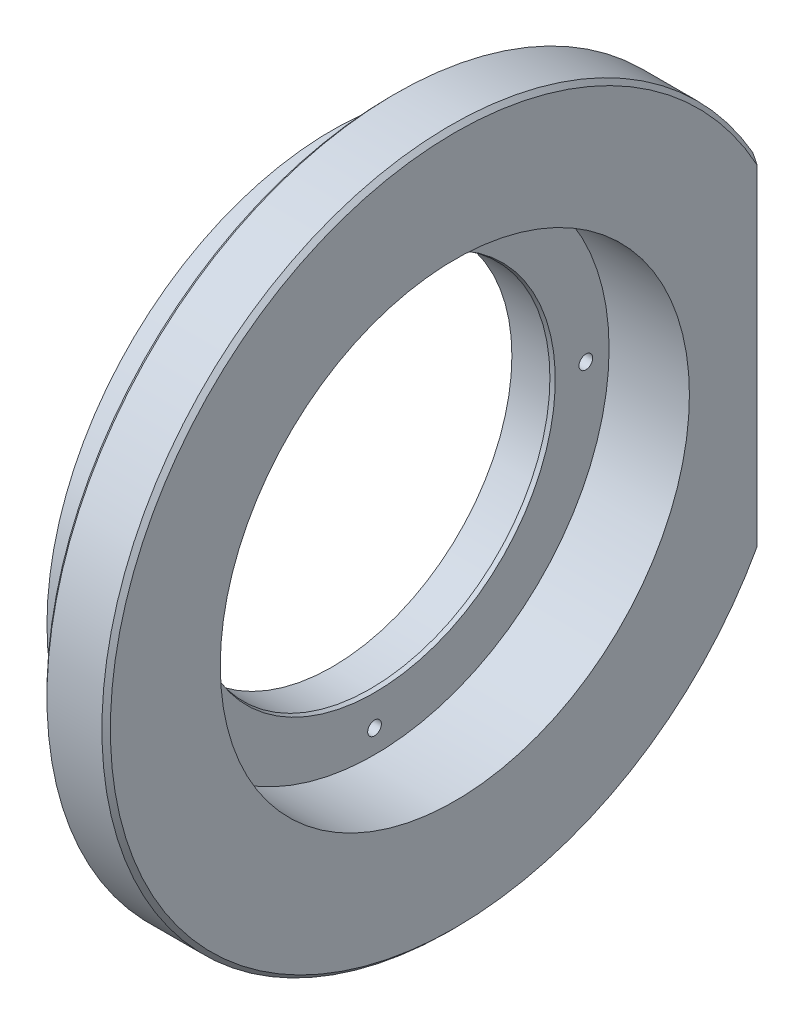
from build123d import *

# Parameters (mm, degrees)
EXTRUDE_1_DEPTH           = 15
SKETCH_2_W                = 14
SKETCH_2_H                = 67.5
HOLE_WIZARD_1_D           = 85
HOLE_WIZARD_1_CBORE_D     = 111
HOLE_WIZARD_1_CBORE_DEPTH = 19
HOLE_WIZARD_2_D           = 3.242
HOLE_WIZARD_2_DEPTH       = 8
HOLE_WIZARD_2_TIP         = 0.973995063
CHAMFER_1_SIZE            = 0.999999999
CHAMFER_1_SIZE2           = 1.000000001
CHAMFER_2_SIZE            = 0.267949192
CHAMFER_2_SIZE2           = 1


with BuildPart() as part:
    # 草圖1 → 填料-伸長1 (new body)
    with BuildSketch(Plane(origin=(125, 0, 0), x_dir=(0, -1, 0), z_dir=(-1, 0, 0))):
        with BuildLine():
            Line((-41.158231255, -71.5), (41.158231255, -71.5))
            ThreePointArc((41.158231255, -71.5), (0, 82.5), (-41.158231255, -71.5))
        make_face()
    extrude(amount=-EXTRUDE_1_DEPTH)

    # 草圖2 → 旋轉1 (revolve)
    with BuildSketch(Plane.XY, mode=Mode.PRIVATE) as revolve_1_sk:
        with Locations((118, 33.75)):
            Rectangle(SKETCH_2_W, SKETCH_2_H)
    revolve(revolve_1_sk.sketch.rotate(Axis((111, 0, 0), (1, 0, 0)), 270), axis=Axis((111, 0, 0), (1, 0, 0)))

    # 鑽孔1 (through all)
    with Locations(Plane(origin=(140, 0, 0), x_dir=(0, 0, -1), z_dir=(1, 0, 0))):
        with Locations((0, 0)):
            CounterBoreHole(HOLE_WIZARD_1_D / 2, HOLE_WIZARD_1_CBORE_D / 2, HOLE_WIZARD_1_CBORE_DEPTH)

    # 鑽孔2
    with Locations(Plane(origin=(121, 0, 0), x_dir=(0, 0, -1), z_dir=(1, 0, 0))):
        with Locations((0, 50), (-50, 0), (0, -50), (50, 0)):
            Hole(HOLE_WIZARD_2_D / 2, depth=HOLE_WIZARD_2_DEPTH)
            with Locations((0, 0, -(HOLE_WIZARD_2_DEPTH + HOLE_WIZARD_2_TIP / 2))):  # 118° drill point
                Cone(0, HOLE_WIZARD_2_D / 2, HOLE_WIZARD_2_TIP, mode=Mode.SUBTRACT)

    # 導角1
    chamfer_1_edges = [part.edges().sort_by_distance(p)[0] for p in [
        (125, 0, 82.5),
        (140, 0, 82.5),
    ]]
    chamfer_1_side = [part.faces().sort_by_distance(p)[0] for p in [
        (132.5, 0, 82.5),
    ]]
    chamfer(chamfer_1_edges, length=CHAMFER_1_SIZE, length2=CHAMFER_1_SIZE2, reference=chamfer_1_side[0])

    # 導角2
    chamfer_2_edges = [part.edges().sort_by_distance(p)[0] for p in [
        (121, 0, -42.5),
    ]]
    chamfer_2_side = [part.faces().sort_by_distance(p)[0] for p in [
        (121, 0, 53.930222946),
    ]]
    chamfer(chamfer_2_edges, length=CHAMFER_2_SIZE, length2=CHAMFER_2_SIZE2, reference=chamfer_2_side[0])


solid = part.part
